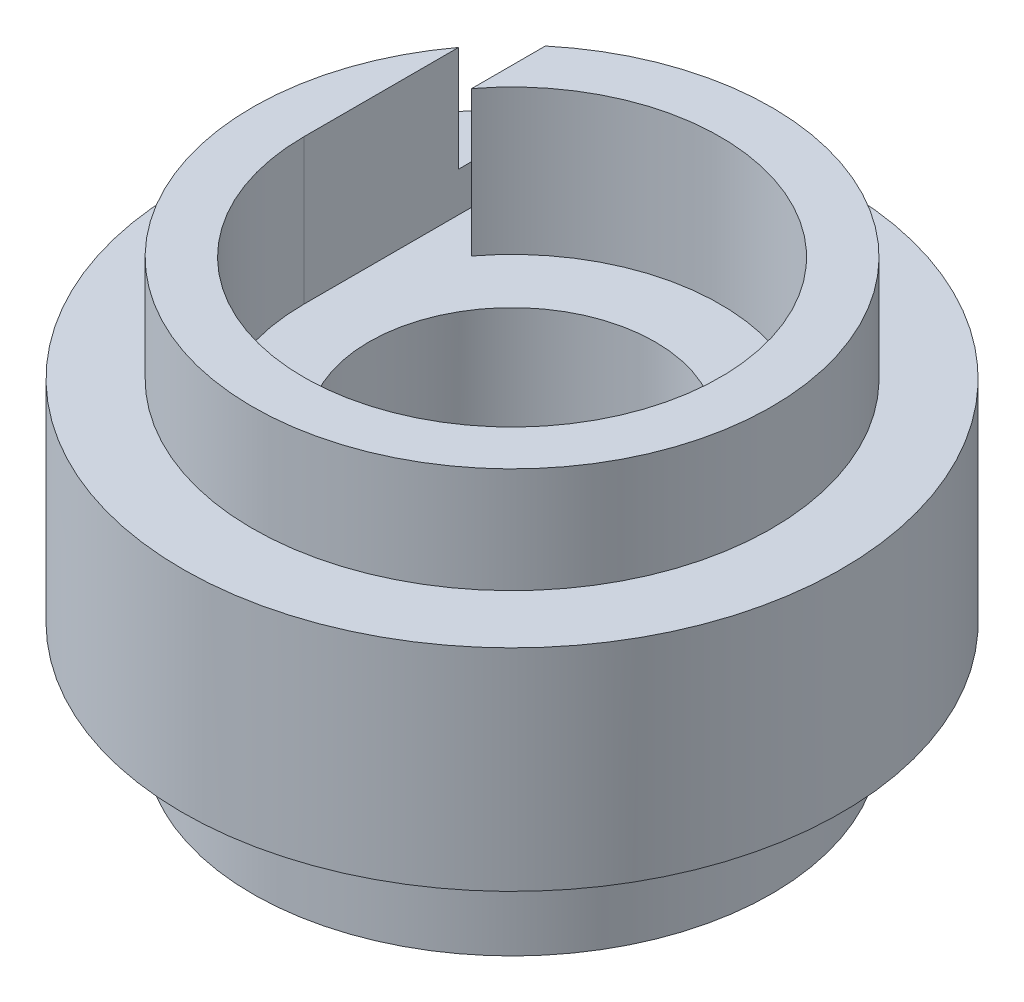
from build123d import *

# Parameters (mm, degrees)
SKETCH1_R           = 31.75
SKETCH1_R_2         = 13.788571429
BOSS_EXTRUDE1_DEPTH = 20.32
CUT_EXTRUDE1_DEPTH  = 13.97
SKETCH13_R          = 31.75
SKETCH13_R_2        = 25
CUT_EXTRUDE2_DEPTH  = 10.16
CIRPATTERN1_COUNT   = 2


with BuildPart() as part:
    # Sketch1 → Boss-Extrude1 (new, symmetric)
    with BuildSketch(Plane(origin=(0, 0, 0), x_dir=(1, 0, 0), z_dir=(0, 1, 0))):
        with Locations(Location((0, 0, 0), (0, 0, 270))):
            Circle(SKETCH1_R)
        with Locations(Location((0, 0, 0), (0, 0, 270))):
            Circle(SKETCH1_R_2, mode=Mode.SUBTRACT)
    extrude(amount=BOSS_EXTRUDE1_DEPTH, both=True)

    # Sketch2 → Cut-Extrude1 (cut)
    with BuildSketch(Plane(origin=(0, 20.32, 0), x_dir=(1, 0, 0), z_dir=(0, 1, 0))):
        with BuildLine():
            Line((-20.066, 0), (-20.066, 24.60524627))
            ThreePointArc((-20.066, 24.60524627), (-18.088933462, 26.093159759), (-16.002, 27.422590979))
            Line((-16.002, 27.422590979), (-16.002, 12.107037292))
            ThreePointArc((-16.002, 12.107037292), (19.022887373, -6.385460986), (-20.066, 0))
        make_face()
    cut_extrude1 = extrude(amount=-CUT_EXTRUDE1_DEPTH, mode=Mode.SUBTRACT)

    # Sketch13 → Cut-Extrude2 (cut)
    with BuildSketch(Plane(origin=(0, 20.32, 0), x_dir=(1, 0, 0), z_dir=(0, 1, 0))):
        with Locations(Location((0, 0, 0), (0, 0, 120.264992611))):
            Circle(SKETCH13_R)
        Circle(SKETCH13_R_2, mode=Mode.SUBTRACT)
    cut_extrude2 = extrude(amount=-CUT_EXTRUDE2_DEPTH, mode=Mode.SUBTRACT)

    # CirPattern1: Cut-Extrude1, Cut-Extrude2 ×2 about axis
    cirpattern1_axis = Axis((0, 0, 0), (0, 0, 1))
    add([cut_extrude1.rotate(cirpattern1_axis, i * 360 / CIRPATTERN1_COUNT) for i in range(1, CIRPATTERN1_COUNT)], mode=Mode.SUBTRACT)
    add([cut_extrude2.rotate(cirpattern1_axis, i * 360 / CIRPATTERN1_COUNT) for i in range(1, CIRPATTERN1_COUNT)], mode=Mode.SUBTRACT)


solid = part.part
